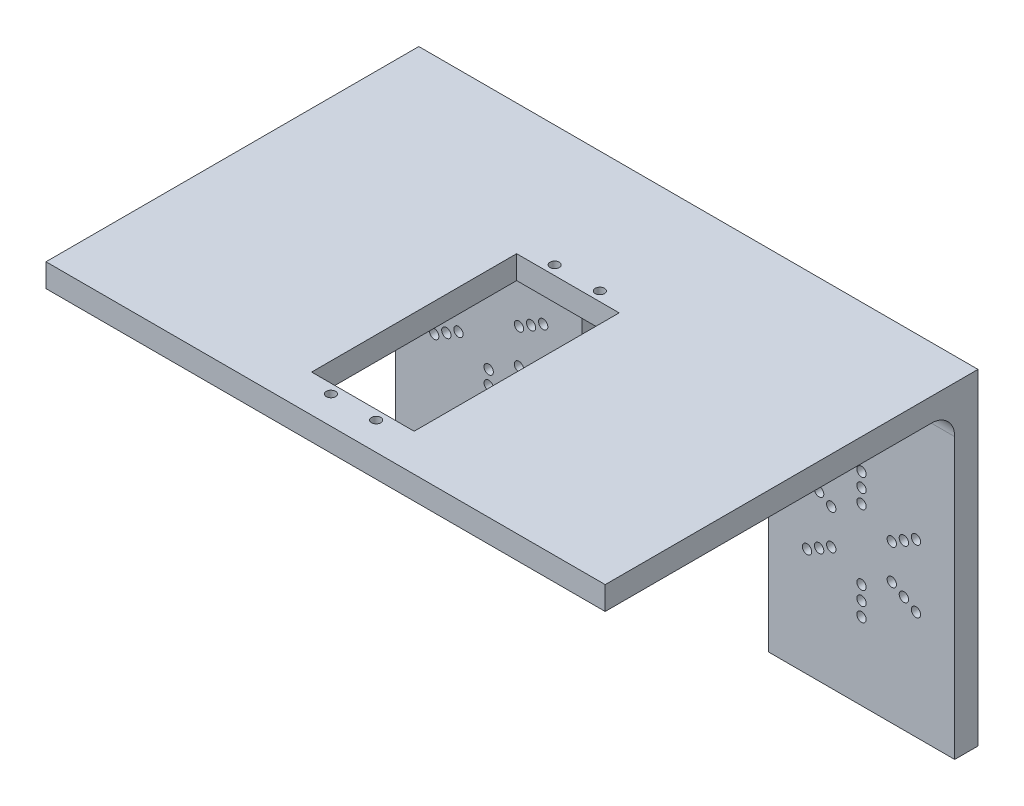
from build123d import *

# Parameters (mm, degrees)
SKETCH1_W           = 120
SKETCH1_H           = 60
SKETCH1_R           = 1
SKETCH1_W_2         = 22
SKETCH1_H_2         = 44
SKETCH1_H_3         = 20
BOSS_EXTRUDE1_DEPTH = 35
CUT_EXTRUDE1_REACH  = 171.853
SKETCH2_W           = 75
SKETCH2_H           = 65
SKETCH3_W           = 40
SKETCH3_H           = 65
CUT_EXTRUDE2_DEPTH  = 5
FILLET1_R           = 5
SKETCH4_R           = 1
CUT_EXTRUDE3_DEPTH  = 5


with BuildPart() as part:
    # Sketch1 → Boss-Extrude1 (new, symmetric)
    # profile 1 of 2: a face of its own
    with BuildSketch(Plane(origin=(0, 0, 0), x_dir=(1, 0, 0), z_dir=(0, 1, 0))):
        Rectangle(SKETCH1_W, SKETCH1_H)
        with Locations(Location((-4.85, -24, 0), (0, 0, 270))):
            Circle(SKETCH1_R, mode=Mode.SUBTRACT)
        Rectangle(SKETCH1_W_2, SKETCH1_H_2, mode=Mode.SUBTRACT)
        with Locations(Location((4.85, -24, 0), (0, 0, 270))):
            Circle(SKETCH1_R, mode=Mode.SUBTRACT)
        with Locations(Location((-4.85, 24, 0), (0, 0, 270))):
            Circle(SKETCH1_R, mode=Mode.SUBTRACT)
        with Locations(Location((4.85, 24, 0), (0, 0, 270))):
            Circle(SKETCH1_R, mode=Mode.SUBTRACT)
    # profile 2 of 2: a face of its own
    with BuildSketch(Plane(origin=(0, 0, 0), x_dir=(1, 0, 0), z_dir=(0, 1, 0))):
        with Locations((0, 40)):
            Rectangle(SKETCH1_W, SKETCH1_H_3)
    extrude(amount=BOSS_EXTRUDE1_DEPTH, both=True)

    # Cut-Extrude1: up to this face of the body (flat: up to its plane)
    cut_extrude1_end = Plane(part.part.faces().sort_by_distance((60, 0, -10))[0])
    # Sketch2 → Cut-Extrude1 (cut, up to the picked face)
    with BuildSketch(Plane(origin=(-60, 0, -85), x_dir=(0, 0, -1), z_dir=(1, 0, 0)), mode=Mode.PRIVATE) as cut_extrude1_sk1:
        with Locations((-77.5, -2.5)):
            Rectangle(SKETCH2_W, SKETCH2_H)
    cut_extrude1_tool1 = split(extrude(cut_extrude1_sk1.sketch, amount=CUT_EXTRUDE1_REACH, mode=Mode.PRIVATE), bisect_by=cut_extrude1_end, keep=Keep.BOTH, mode=Mode.PRIVATE)
    add(cut_extrude1_tool1.solids().sort_by(Axis((-60, -2.5, -7.5), (1, 0, 0)))[0], mode=Mode.SUBTRACT)

    # Sketch3 → Cut-Extrude2 (cut)
    with BuildSketch(Plane(origin=(0, 0, -50), x_dir=(-1, 0, 0), z_dir=(0, 0, -1))):
        with Locations((0, -2.5)):
            Rectangle(SKETCH3_W, SKETCH3_H)
    extrude(amount=-CUT_EXTRUDE2_DEPTH, mode=Mode.SUBTRACT)

    # Fillet1
    fillet1_edges = [part.edges().sort_by_distance(p)[0] for p in [
        (40, 30, -45),
        (-40, 30, -45),
        (-20, 30, -47.5),
        (20, 30, -47.5),
    ]]
    fillet(fillet1_edges, radius=FILLET1_R)

    # Sketch4 → Cut-Extrude3 (cut)
    with BuildSketch(Plane.XY.offset(-45)):
        with Locations((-40, -18.5)):
            Circle(SKETCH4_R)
        with Locations((-40, -15.5)):
            Circle(SKETCH4_R)
        with Locations((-40, -12.5)):
            Circle(SKETCH4_R)
        with Locations((-46.495190528, -8.75)):
            Circle(SKETCH4_R)
        with Locations((-49.09326674, -10.25)):
            Circle(SKETCH4_R)
        with Locations((-51.691342951, -11.75)):
            Circle(SKETCH4_R)
        with Locations((-46.495190528, -1.25)):
            Circle(SKETCH4_R)
        with Locations((-49.09326674, 0.25)):
            Circle(SKETCH4_R)
        with Locations((-51.691342951, 1.75)):
            Circle(SKETCH4_R)
        with Locations((-40, 2.5)):
            Circle(SKETCH4_R)
        with Locations((-40, 5.5)):
            Circle(SKETCH4_R)
        with Locations((-40, 8.5)):
            Circle(SKETCH4_R)
        with Locations((-33.504809472, -1.25)):
            Circle(SKETCH4_R)
        with Locations((-30.90673326, 0.25)):
            Circle(SKETCH4_R)
        with Locations((-28.308657049, 1.75)):
            Circle(SKETCH4_R)
        with Locations((-33.504809472, -8.75)):
            Circle(SKETCH4_R)
        with Locations((-30.90673326, -10.25)):
            Circle(SKETCH4_R)
        with Locations((-28.308657049, -11.75)):
            Circle(SKETCH4_R)
        with Locations((40, -18.5)):
            Circle(SKETCH4_R)
        with Locations((40, -15.5)):
            Circle(SKETCH4_R)
        with Locations((40, -12.5)):
            Circle(SKETCH4_R)
        with Locations((33.504809472, -8.75)):
            Circle(SKETCH4_R)
        with Locations((30.90673326, -10.25)):
            Circle(SKETCH4_R)
        with Locations((28.308657049, -11.75)):
            Circle(SKETCH4_R)
        with Locations((33.504809472, -1.25)):
            Circle(SKETCH4_R)
        with Locations((30.90673326, 0.25)):
            Circle(SKETCH4_R)
        with Locations((28.308657049, 1.75)):
            Circle(SKETCH4_R)
        with Locations((40, 2.5)):
            Circle(SKETCH4_R)
        with Locations((40, 5.5)):
            Circle(SKETCH4_R)
        with Locations((40, 8.5)):
            Circle(SKETCH4_R)
        with Locations((46.495190528, -1.25)):
            Circle(SKETCH4_R)
        with Locations((49.09326674, 0.25)):
            Circle(SKETCH4_R)
        with Locations((51.691342951, 1.75)):
            Circle(SKETCH4_R)
        with Locations((46.495190528, -8.75)):
            Circle(SKETCH4_R)
        with Locations((49.09326674, -10.25)):
            Circle(SKETCH4_R)
        with Locations((51.691342951, -11.75)):
            Circle(SKETCH4_R)
    extrude(amount=-CUT_EXTRUDE3_DEPTH, mode=Mode.SUBTRACT)


solid = part.part
